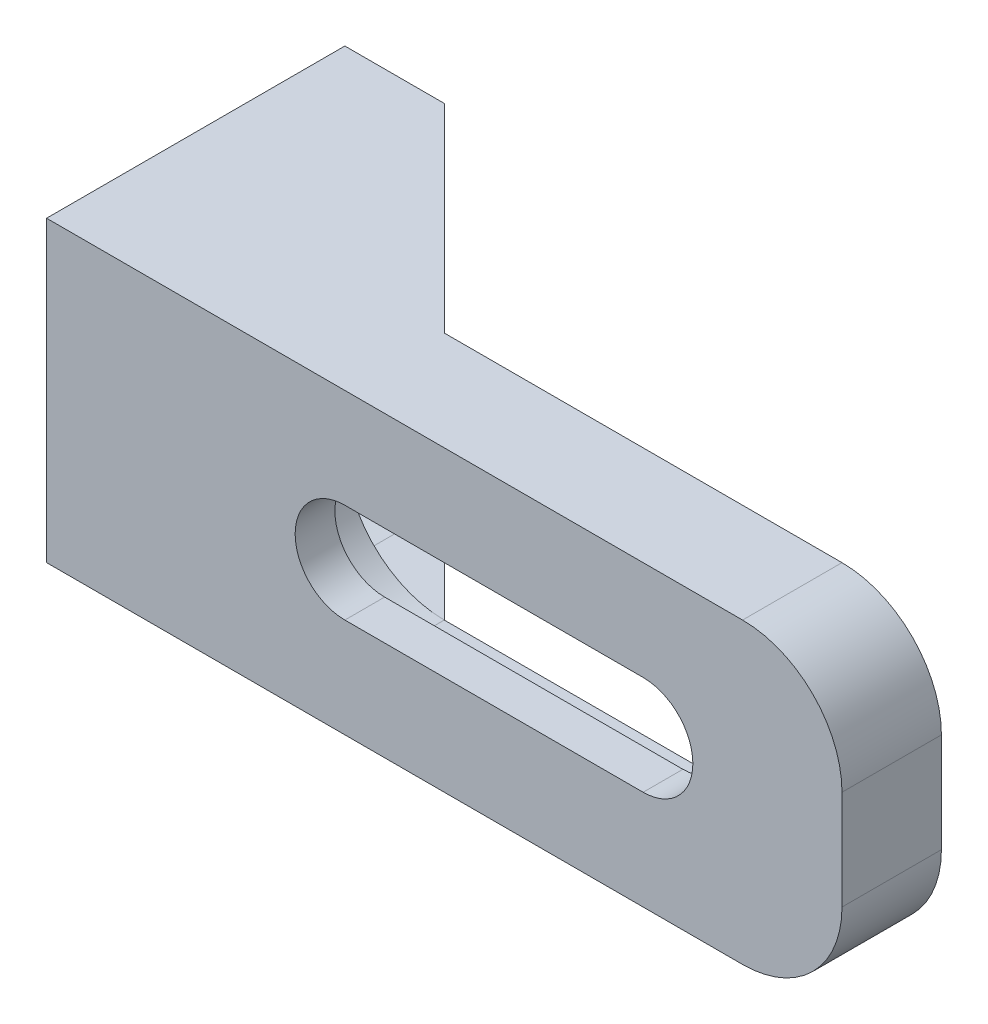
from build123d import *

# Parameters (mm, degrees)
EXTRUDE_1_DEPTH     = 2
EXTRUDE_2_DEPTH     = 5
EXTRUDE_3_DEPTH     = 15
EXTRUDE_4_DEPTH     = 15
CUT_EXTRUDE_START   = -5
CUT_EXTRUDE_1_DEPTH = 15


with BuildPart() as part:
    # Эскиз1 → Бобышка-Вытянуть1 (new body)
    with BuildSketch(Plane.XY):
        with BuildLine():
            Line((15, 7.5), (-20, 7.5))
            Line((-20, 7.5), (-20, -7.5))
            Line((-20, -7.5), (15, -7.5))
            ThreePointArc((15, -7.5), (18.535533906, -6.035533906), (20, -2.5))
            Line((20, -2.5), (20, 2.5))
            ThreePointArc((20, 2.5), (18.535533906, 6.035533906), (15, 7.5))
        make_face()
        with BuildLine():
            Line((10, -2.5), (-5, -2.5))
            ThreePointArc((-5, -2.5), (-7.5, 0), (-5, 2.5))
            Line((-5, 2.5), (10, 2.5))
            ThreePointArc((10, 2.5), (12.5, 0), (10, -2.5))
        make_face(mode=Mode.SUBTRACT)
    extrude(amount=-EXTRUDE_1_DEPTH)

    # Эскиз1<3> → Бобышка-Вытянуть2 (add)
    with BuildSketch(Plane.XY):
        with BuildLine():
            Line((15, 7.5), (-20, 7.5))
            Line((-20, 7.5), (-20, -7.5))
            Line((-20, -7.5), (15, -7.5))
            ThreePointArc((15, -7.5), (18.535533906, -6.035533906), (20, -2.5))
            Line((20, -2.5), (20, 2.5))
            ThreePointArc((20, 2.5), (18.535533906, 6.035533906), (15, 7.5))
        make_face()
        with BuildLine():
            ThreePointArc((-5, -5), (-10, 0), (-5, 5))
            Line((-5, 5), (10, 5))
            ThreePointArc((10, 5), (15, 0), (10, -5))
            Line((10, -5), (-5, -5))
        make_face(mode=Mode.SUBTRACT)
    extrude(amount=-EXTRUDE_2_DEPTH)

    # Эскиз1<4> → Бобышка-Вытянуть3 (add)
    with BuildSketch(Plane.XY):
        Polygon((-15, 0), (-15, 7.5), (-20, 7.5), (-20, -7.5), (-15, -7.5), align=None)
    extrude(amount=-EXTRUDE_3_DEPTH)

    # Эскиз2 → Бобышка-Вытянуть4 (add)
    with BuildSketch(Plane(origin=(0, 7.5, 0), x_dir=(1, 0, 0), z_dir=(0, 1, 0))):
        Polygon((-15, 15), (-5, 5), (-15, 5), align=None)
    extrude(amount=-EXTRUDE_4_DEPTH)

    # Эскиз1<5> → Вырез-Вытянуть1 (cut)
    with BuildSketch(Plane.XY.offset(CUT_EXTRUDE_START)):
        with BuildLine():
            Line((-10, 5), (10, 5))
            ThreePointArc((10, 5), (15, 0), (10, -5))
            Line((10, -5), (-10, -5))
            ThreePointArc((-10, -5), (-15, 0), (-10, 5))
        make_face()
    extrude(amount=-CUT_EXTRUDE_1_DEPTH, mode=Mode.SUBTRACT)


solid = part.part
